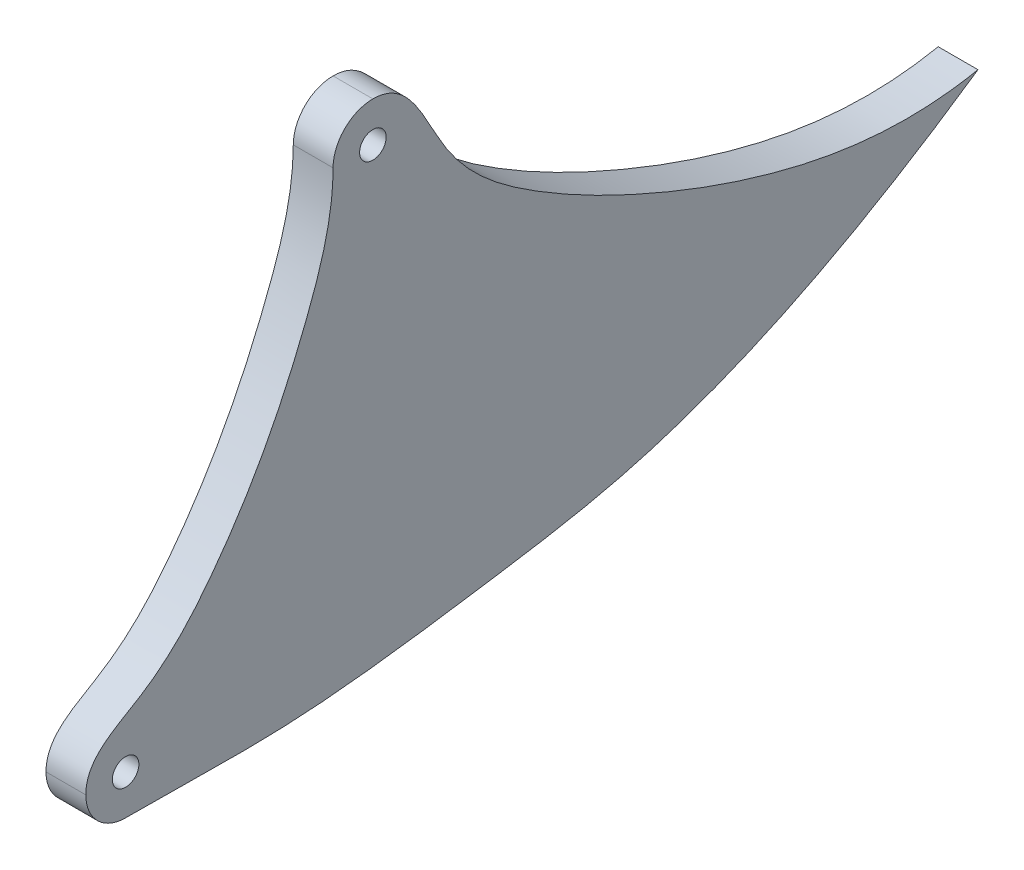
from build123d import *

# Parameters (mm, degrees)
SKETCH3_R               = 1
BOSS_EXTRUDE5_DEPTH     = 3
SCALE1_SCALE            = 2
CUT_EXTRUDE5_DEPTH      = 169.726308855
CUT_EXTRUDE5_DEPTH_BACK = 169.726308855


with BuildPart() as part:
    # Sketch3 → Boss-Extrude5 (new body)
    with BuildSketch(Plane.YZ):
        with BuildLine():
            ThreePointArc((58.616178362, 81.95585305), (72.28925789, 72.27810524), (87.376543516, 64.998976247))
            ThreePointArc((87.376543516, 64.998976247), (93.786143569, 56.077468251), (88.138513247, 46.655125151))
            ThreePointArc((88.138513247, 46.655125151), (71.600232607, 31.643356681), (65.894311053, 10.049135733))
            ThreePointArc((65.894311053, 10.049135733), (49.067055906, 40.095465981), (42.191228891, 73.83952442))
            ThreePointArc((42.191228891, 73.83952442), (47.750428524, 83.267100384), (58.616178362, 81.95585305))
        make_face()
        with Locations(Location((52.180531975, 74.301935388, 0), (0, 0, 270))):
            Circle(SKETCH3_R, mode=Mode.SUBTRACT)
        with Locations(Location((83.794759513, 55.662444591, 0), (0, 0, 270))):
            Circle(SKETCH3_R, mode=Mode.SUBTRACT)
    extrude(amount=BOSS_EXTRUDE5_DEPTH)


with BuildPart() as part_1:
    # Scale1: scaled about (1.5, 64.281072496, 53.592591701)
    add(part.part.scale(SCALE1_SCALE).moved(Location((-1.5, -64.281072496, -53.592591701))))

    # Sketch4 → Cut-Extrude5 (cut, two sides: drawn at the far end of the back side and taken through both)
    # profile 1 of 2: a face of its own
    with BuildSketch(Plane.YZ.offset(4.5).offset(-CUT_EXTRUDE5_DEPTH_BACK)):
        with BuildLine():
            ThreePointArc((40.079991453, 131.011279074), (14.624147331, 120.467123197), (4.079991453, 95.011279074))
            add(Edge.make_bspline(
                [(4.079991453, 95.011279074), (4.079991453, 94.242129242), (4.074736847, 92.693156501), (4.048337034, 89.680686516), (3.974452339, 84.474909584), (3.891847824, 78.420908281), (3.99046349, 71.890021758), (4.222111607, 66.686290889), (4.600519231, 61.600350874), (5.252018982, 54.917807934), (6.072945677, 48.412082806), (6.968279008, 42.107389494), (7.654940544, 37.508180907), (8.338977905, 32.998453634), (9.097399323, 28.237241992), (9.964045635, 23.297685745), (10.986829459, 18.169836559), (12.221548821, 12.841198098), (14.199009132, 5.613890247), (17.113480984, -3.045534085), (21.220845798, -13.012605057), (25.806575019, -22.522764631), (29.93715003, -30.090595401), (33.376360032, -35.936065317), (36.010945306, -40.217064113), (38.24368405, -43.701146971), (40.044055598, -46.435380718), (41.179179132, -48.129591146), (42.079886953, -49.458241111), (42.783926409, -50.487408233), (43.384399662, -51.361744901), (44.220481131, -52.580552001), (45.253465848, -54.085936749), (47.742602114, -57.713777133), (51.472117762, -63.149272402), (56.447199413, -70.400180423), (61.421640585, -77.650130449), (68.054452543, -87.317065127), (76.345390718, -99.400618643), (86.29454944, -113.900932088), (96.243699354, -128.40123236), (109.509235664, -147.734970678), (119.458387201, -162.235273376), (126.091155046, -171.902142073)],
                knots=[0, 0, 0, 0, 0.016392682, 0.032785364, 0.065570729, 0.131141457, 0.163926822, 0.196712186, 0.22949755, 0.262282915, 0.327853643, 0.360639008, 0.393424372, 0.426209737, 0.458995101, 0.491780465, 0.52456583, 0.557351194, 0.590136558, 0.655707287, 0.721278016, 0.786848744, 0.852419473, 0.885204837, 0.917990202, 0.950775566, 0.967168248, 0.98356093, 0.991757272, 0.999953613, 1.008149954, 1.016346295, 1.032738977, 1.049131659, 1.114702388, 1.180273117, 1.245843845, 1.311414574, 1.442556031, 1.573697489, 1.704838946, 1.835980404, 2.098263318, 2.098263318, 2.098263318, 2.098263318], degree=3))
            add(Edge.make_bspline(
                [(126.091155046, -171.902142073), (123.985018628, -161.482615386), (120.825814001, -145.853325356), (116.613541165, -125.014271982), (113.454336538, -109.384981952), (110.821666016, -96.360573593), (108.715529598, -85.941046907), (107.135927284, -78.126401888), (105.556324973, -70.311756886), (103.97672265, -62.497111822), (102.660387419, -55.984907793), (101.607319148, -50.775144144), (100.81751818, -46.867822569), (100.027716313, -42.960496559), (99.23791781, -39.05318713), (98.579741925, -35.797044363), (98.053224653, -33.192245642), (97.724098002, -31.563983499), (97.460918876, -30.261975973), (97.263199961, -29.283821528), (97.099498519, -28.473937913), (96.991153076, -27.937955464), (96.943185818, -27.700624072), (96.906169944, -27.517576786), (96.896663698, -27.469942797), (96.874882695, -27.35858588), (96.850232596, -27.228592193), (96.80693366, -26.991407151), (96.750533174, -26.654274954), (96.689638273, -26.242438461), (96.618116469, -25.686041739), (96.546542868, -24.973802166), (96.489702765, -24.088416412), (96.462723233, -23.168620317), (96.467985463, -21.892756669), (96.554960531, -20.199637556), (96.877349892, -17.271247823), (97.49078779, -14.012089591), (98.394324434, -10.468195168), (99.488963606, -6.727060482), (100.78770421, -2.93910188), (102.282422629, 0.901325848), (103.921843826, 4.820115669), (105.682090306, 8.642317067), (107.508186532, 12.205324018), (108.913570174, 14.749019555), (110.091398417, 16.720010195), (111.065785789, 18.250951253), (111.926595057, 19.541801582), (112.568745424, 20.404162052), (113.00398931, 20.921276954), (113.231370742, 21.164828718), (113.37391468, 21.300651925), (113.441217367, 21.35752281), (113.48404207, 21.390639508), (113.5118942, 21.411299137), (113.55967328, 21.442859324), (113.566057267, 21.448447599), (113.821004288, 21.600359584), (114.57013143, 22.021149636), (116.170886169, 22.884337253), (119.076998546, 24.505489793), (122.963756354, 26.975585488), (127.836672348, 30.85246546), (132.460175497, 36.075425025), (135.781859956, 41.812908372), (137.782816306, 46.807198567), (138.831730274, 51.338471128), (139.242484882, 55.015832455), (139.30844653, 56.823612475), (139.30844653, 57.732297481)],
                knots=[-1.365452964, -1.365452964, -1.365452964, -1.365452964, -1.069771343, -0.921930533, -0.774089723, -0.626248913, -0.552328507, -0.478408102, -0.404487697, -0.330567292, -0.256646887, -0.219686684, -0.182726482, -0.145766279, -0.108806077, -0.071845874, -0.053365773, -0.034885672, -0.025645621, -0.01640557, -0.00716552, -0.002545494, -0.001390488, -0.000235482, 0.002074531, 0.004384544, 0.006694556, 0.011314582, 0.020554632, 0.029794683, 0.039034733, 0.057514835, 0.075994936, 0.094475037, 0.112955139, 0.149915341, 0.186875544, 0.260795949, 0.297756151, 0.334716354, 0.408636759, 0.445596962, 0.482557164, 0.556477569, 0.593437772, 0.630397974, 0.667358177, 0.685838278, 0.70431838, 0.741278582, 0.759758683, 0.778238785, 0.796718886, 0.815198987, 0.824439038, 0.833679088, 0.842919139, 0.85215919, 0.86139924, 0.870639291, 0.889119392, 0.907599494, 0.926079595, 0.944559696, 0.963039797, 0.972279848, 0.981519899, 0.990759949, 0.995379975, 1, 1, 1, 1], degree=3))
            ThreePointArc((139.30844653, 57.732297481), (128.764290653, 83.188141603), (103.30844653, 93.732297481))
            add(Edge.make_bspline(
                [(103.30844653, 93.732297481), (103.202032971, 93.732297481), (103.007697458, 93.739116054), (102.472849158, 93.792883633), (101.43443303, 93.986019436), (99.642206902, 94.52157707), (97.739848637, 95.206220035), (96.019115769, 95.869540428), (94.310601822, 96.559703633), (92.086817568, 97.503181877), (89.395049368, 98.73399751), (86.338581131, 100.284667381), (83.419629399, 101.934513165), (80.615286356, 103.695746498), (78.644778896, 105.071693143), (77.405698286, 105.996157317), (76.586507515, 106.624195237), (75.765978417, 107.284686239), (75.083266864, 107.883887257), (74.657873948, 108.300516041), (74.463871137, 108.516956797), (74.366409797, 108.636103214), (74.311607859, 108.708542247), (74.275294642, 108.759850683), (74.243015889, 108.809263828), (74.222791814, 108.839644471), (73.925272173, 109.330140176), (73.212926073, 110.547511608), (72.109275507, 112.373444427), (70.5137299, 114.791361557), (68.236502501, 117.782036338), (64.996256489, 121.257946426), (60.470315968, 124.951107004), (54.485312277, 128.298527372), (48.564489528, 130.169527535), (43.667900661, 130.89697055), (41.282658048, 131.011279074), (40.079991453, 131.011279074)],
                knots=[0, 0, 0, 0, 0.03125, 0.0625, 0.125, 0.1875, 0.21875, 0.25, 0.28125, 0.3125, 0.375, 0.4375, 0.5, 0.5625, 0.625, 0.640625, 0.65625, 0.6875, 0.71875, 0.75, 0.78125, 0.796875, 0.8125, 0.828125, 0.8359375, 0.84375, 0.859375, 0.875, 0.890625, 0.90625, 0.921875, 0.9375, 0.953125, 0.96875, 0.984375, 0.9921875, 1, 1, 1, 1], degree=3))
        make_face()
        with BuildLine():
            ThreePointArc((110.472014535, 76.405360792), (80.297443284, 90.963618778), (52.951284228, 110.319114398))
            ThreePointArc((52.951284228, 110.319114398), (31.219784552, 112.941609068), (20.101385286, 94.08645714))
            ThreePointArc((20.101385286, 94.08645714), (33.853039316, 26.598340261), (67.507549609, -33.494320234))
            ThreePointArc((67.507549609, -33.494320234), (78.919392718, 9.694121661), (111.995953998, 39.7176586))
            ThreePointArc((111.995953998, 39.7176586), (123.291214642, 58.562344802), (110.472014535, 76.405360792))
        make_face(mode=Mode.SUBTRACT)
    # profile 2 of 2: a face of its own
    with BuildSketch(Plane.YZ.offset(4.5).offset(-CUT_EXTRUDE5_DEPTH_BACK)):
        with BuildLine():
            ThreePointArc((20.101385286, 94.08645714), (33.853039316, 26.598340261), (67.507549609, -33.494320234))
            ThreePointArc((67.507549609, -33.494320234), (78.919392718, 9.694121661), (111.995953998, 39.7176586))
            ThreePointArc((111.995953998, 39.7176586), (123.291214642, 58.562344802), (110.472014535, 76.405360792))
            ThreePointArc((110.472014535, 76.405360792), (80.297443284, 90.963618778), (52.951284228, 110.319114398))
            ThreePointArc((52.951284228, 110.319114398), (31.219784552, 112.941609068), (20.101385286, 94.08645714))
        make_face()
        with BuildLine():
            ThreePointArc((34.079991453, 95.011279074), (35.837350766, 99.253919762), (40.079991453, 101.011279074))
            add(Edge.make_bspline(
                [(103.30844653, 63.732297481), (96.907989469, 63.732297481), (86.512556573, 67.051396318), (71.583405869, 73.750335641), (58.757394587, 81.971495884), (48.737235457, 91.072904313), (44.718110726, 101.011279074), (40.079991453, 101.011279074)],
                knots=[0, 0, 0, 0, 0.240382727, 0.442268984, 0.65027899, 0.84010296, 1, 1, 1, 1], degree=3))
            ThreePointArc((103.30844653, 63.732297481), (107.551087217, 61.974938168), (109.30844653, 57.732297481))
            add(Edge.make_bspline(
                [(67.507549609, -33.494320234), (65.209333782, -22.124533864), (67.845301717, -5.291445952), (76.146657359, 16.996811503), (84.613175985, 33.72014987), (95.443729237, 47.593788486), (109.30844653, 52.211064966), (109.30844653, 57.732297481)],
                knots=[0, 0, 0, 0, 0.322647752, 0.479624885, 0.681873315, 0.850485924, 1, 1, 1, 1], degree=3))
            add(Edge.make_bspline(
                [(34.079991453, 95.011279074), (34.079991453, 85.726441666), (33.311442477, 69.429540472), (37.038592928, 43.456050962), (42.76683893, 7.076851592), (56.4465243, -17.373526954), (67.507549609, -33.494320234)],
                knots=[0, 0, 0, 0, 0.180012442, 0.401525543, 0.562608246, 1, 1, 1, 1], degree=3))
        make_face(mode=Mode.SUBTRACT)
    extrude(amount=CUT_EXTRUDE5_DEPTH + CUT_EXTRUDE5_DEPTH_BACK, mode=Mode.SUBTRACT)


solid = part_1.part
